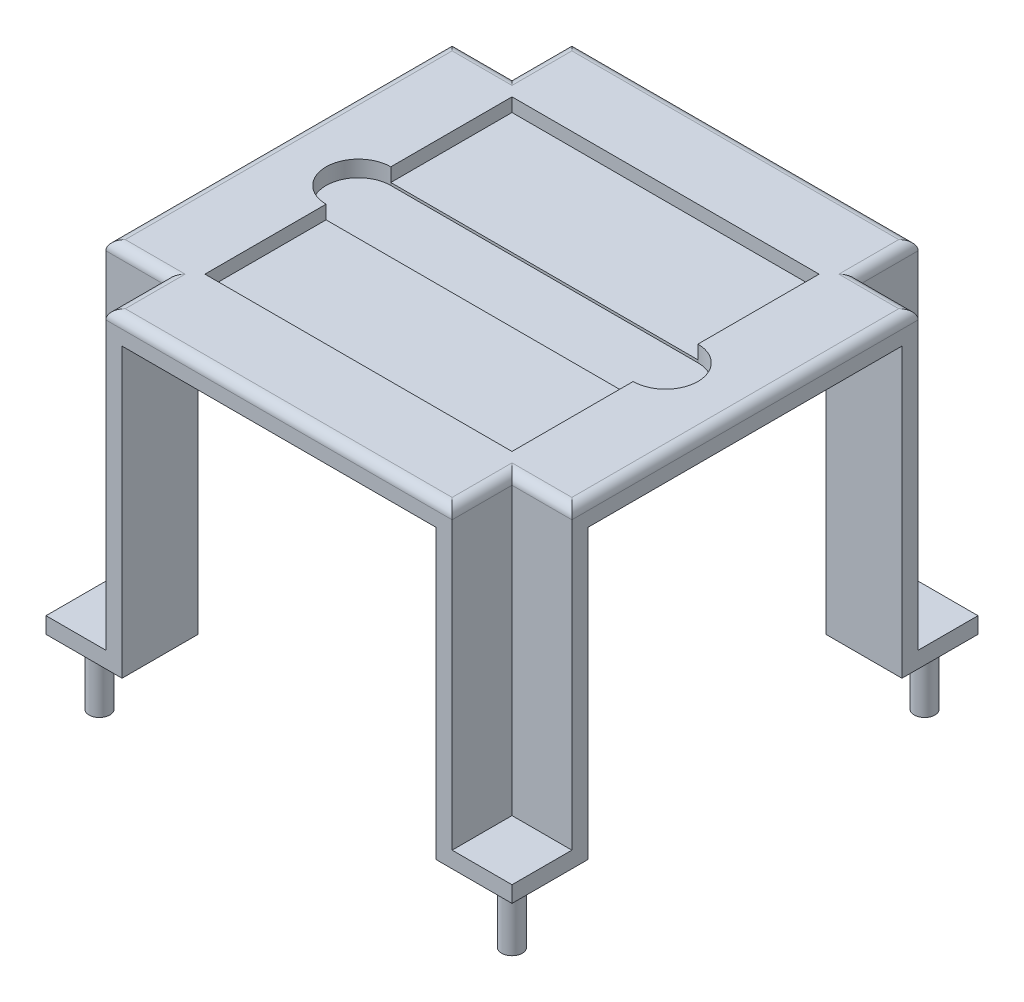
from build123d import *

# Parameters (mm, degrees)
SKETCH1_W             = 18.5
SKETCH1_H             = 18.5
BOSS_EXTRUDE1_DEPTH   = 5
BOSS_EXTRUDE1_2_DEPTH = 5
BOSS_EXTRUDE1_3_DEPTH = 5
BOSS_EXTRUDE1_4_DEPTH = 5
BOSS_EXTRUDE2_DEPTH   = 88.9
SKETCH3_R             = 3.2
BOSS_EXTRUDE3_DEPTH   = 20
BOSS_EXTRUDE4_DEPTH   = 7.5
FILLET1_R             = 3
SKETCH5_W             = 94.9
SKETCH5_H             = 94.9
CUT_EXTRUDE1_DEPTH    = 4.2
CUT_EXTRUDE2_DEPTH    = 5


with BuildPart() as part:
    # Sketch1 → Boss-Extrude1 (new body)
    with BuildSketch(Plane(origin=(0, 0, 0), x_dir=(1, 0, 0), z_dir=(0, 1, 0))):
        with Locations((-62.75, 62.75)):
            Rectangle(SKETCH1_W, SKETCH1_H)
    extrude(amount=BOSS_EXTRUDE1_DEPTH)



with BuildPart() as body_2:
    # Sketch1 → Boss-Extrude1 2 (new body)
    with BuildSketch(Plane(origin=(0, 0, 0), x_dir=(1, 0, 0), z_dir=(0, 1, 0))):
        with Locations((-62.75, -62.75)):
            Rectangle(SKETCH1_W, SKETCH1_H)
    extrude(amount=BOSS_EXTRUDE1_2_DEPTH)


with BuildPart() as body_3:
    # Sketch1 → Boss-Extrude1 3 (new body)
    with BuildSketch(Plane(origin=(0, 0, 0), x_dir=(1, 0, 0), z_dir=(0, 1, 0))):
        with Locations((62.75, -62.75)):
            Rectangle(SKETCH1_W, SKETCH1_H)
    extrude(amount=BOSS_EXTRUDE1_3_DEPTH)


with BuildPart() as body_4:
    # Sketch1 → Boss-Extrude1 4 (new body)
    with BuildSketch(Plane(origin=(0, 0, 0), x_dir=(1, 0, 0), z_dir=(0, 1, 0))):
        with Locations((62.75, 62.75)):
            Rectangle(SKETCH1_W, SKETCH1_H)
    extrude(amount=BOSS_EXTRUDE1_4_DEPTH)


with BuildPart() as part_1:
    add(part.part)

    add(body_2.part)  # Boss-Extrude2 merges body 2

    add(body_3.part)  # Boss-Extrude2 merges body 3

    add(body_4.part)  # Boss-Extrude2 merges body 4
    # Sketch2 → Boss-Extrude2 (add)
    with BuildSketch(Plane.XZ):
        Polygon((-72, -53.5), (-72, -48.5), (-48.5, -48.5), (-48.5, -72), (-53.5, -72), (-53.5, -53.5), align=None)
        Polygon((-72, 53.5), (-53.5, 53.5), (-53.5, 72), (-48.5, 72), (-48.5, 48.5), (-72, 48.5), align=None)
        Polygon((72, -53.5), (53.5, -53.5), (53.5, -72), (48.5, -72), (48.5, -48.5), (72, -48.5), align=None)
        Polygon((72, 53.5), (72, 48.5), (48.5, 48.5), (48.5, 72), (53.5, 72), (53.5, 53.5), align=None)
    extrude(amount=-BOSS_EXTRUDE2_DEPTH)

    # Sketch3 → Boss-Extrude3 (add)
    with BuildSketch(Plane.XZ):
        with Locations(Location((-63.75, 63.75, 0), (0, 0, 270))):
            Circle(SKETCH3_R)
        with Locations(Location((63.75, 63.75, 0), (0, 0, 270))):
            Circle(SKETCH3_R)
        with Locations(Location((-63.75, -63.75, 0), (0, 0, 90))):
            Circle(SKETCH3_R)
        with Locations(Location((63.75, -63.75, 0), (0, 0, 90))):
            Circle(SKETCH3_R)
    extrude(amount=BOSS_EXTRUDE3_DEPTH)

    # Sketch4 → Boss-Extrude4 (add)
    with BuildSketch(Plane(origin=(0, 88.9, 0), x_dir=(1, 0, 0), z_dir=(0, 1, 0))):
        Polygon((-72, 53.5), (-72, -53.5), (-53.5, -53.5), (-53.5, -72), (53.5, -72), (53.5, -53.5), (72, -53.5), (72, 53.5), (53.5, 53.5), (53.5, 72), (-53.5, 72), (-53.5, 53.5), align=None)
    extrude(amount=BOSS_EXTRUDE4_DEPTH)

    # Fillet1
    fillet1_edges = [part_1.edges().sort_by_distance(p)[0] for p in [
        (-62.75, 96.4, -53.5),
        (-72, 96.4, 0),
        (-62.75, 96.4, 53.5),
        (-53.5, 96.4, 62.75),
        (0, 96.4, 72),
        (53.5, 96.4, 62.75),
        (62.75, 96.4, 53.5),
        (72, 96.4, 0),
        (62.75, 96.4, -53.5),
        (53.5, 96.4, -62.75),
        (0, 96.4, -72),
        (-53.5, 96.4, -62.75),
    ]]
    fillet(fillet1_edges, radius=FILLET1_R)

    # Sketch5 → Cut-Extrude1 (cut)
    with BuildSketch(Plane(origin=(0, 96.4, 0), x_dir=(1, 0, 0), z_dir=(0, 1, 0))):
        Rectangle(SKETCH5_W, SKETCH5_H)
    extrude(amount=-CUT_EXTRUDE1_DEPTH, mode=Mode.SUBTRACT)

    # Sketch6 → Cut-Extrude2 (cut)
    with BuildSketch(Plane(origin=(0, 96.4, 0), x_dir=(1, 0, 0), z_dir=(0, 1, 0))):
        with BuildLine():
            Line((-47.45, 10), (47.45, 10))
            ThreePointArc((47.45, 10), (57.45, 0), (47.45, -10))
            Line((47.45, -10), (-47.45, -10))
            ThreePointArc((-47.45, -10), (-57.45, 0), (-47.45, 10))
        make_face()
    extrude(amount=-CUT_EXTRUDE2_DEPTH, mode=Mode.SUBTRACT)


solid = part_1.part
